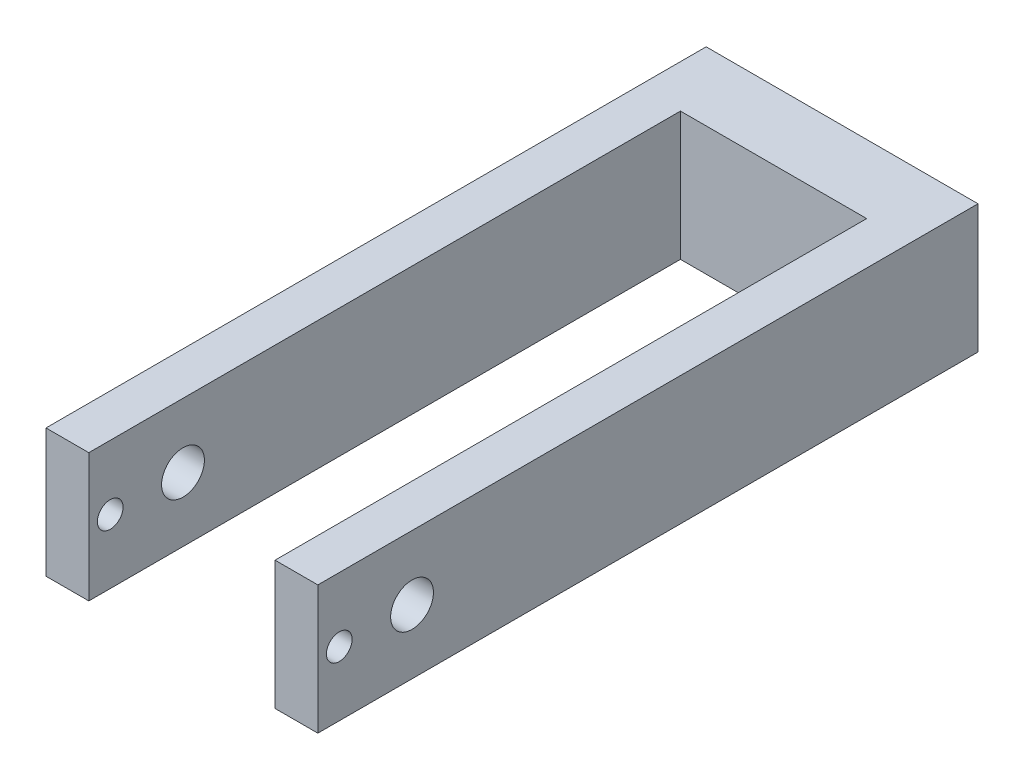
from build123d import *

# Parameters (mm, degrees)
SKETCH1_W           = 31.75
SKETCH1_H           = 15
BOSS_EXTRUDE1_DEPTH = 8
SKETCH2_W           = 5
SKETCH2_H           = 15
BOSS_EXTRUDE2_DEPTH = 69.1
SKETCH3_R           = 2.5
CUT_EXTRUDE1_DEPTH  = 69.1
SKETCH4_R           = 4
SKETCH4_R_2         = 2
CUT_EXTRUDE3_DEPTH  = 4
SKETCH5_R           = 1.5
CUT_EXTRUDE4_DEPTH  = 3
SKETCH6_R           = 1.5
CUT_EXTRUDE5_DEPTH  = 37


with BuildPart() as part:
    # Sketch1 → Boss-Extrude1 (new body)
    with BuildSketch(Plane.XY):
        with Locations((-0.926352113, 0.669031185)):
            Rectangle(SKETCH1_W, SKETCH1_H)
    extrude(amount=BOSS_EXTRUDE1_DEPTH)

    # Sketch2 → Boss-Extrude2 (add)
    with BuildSketch(Plane.XY.offset(8)):
        with Locations((-14.301352113, 0.669031185)):
            Rectangle(SKETCH2_W, SKETCH2_H)
        with Locations((12.448647887, 0.669031185)):
            Rectangle(SKETCH2_W, SKETCH2_H)
    extrude(amount=BOSS_EXTRUDE2_DEPTH)

    # Sketch3 → Cut-Extrude1 (cut)
    with BuildSketch(Plane(origin=(14.948647887, 0, 0), x_dir=(0, 0, -1), z_dir=(1, 0, 0))):
        with Locations(Location((-66.1, 0.669031185, 0), (0, 0, 90))):
            Circle(SKETCH3_R)
    extrude(amount=-CUT_EXTRUDE1_DEPTH, mode=Mode.SUBTRACT)

    # Sketch4 → Cut-Extrude3 (cut)
    with BuildSketch(Plane(origin=(0, 0, 0), x_dir=(-1, 0, 0), z_dir=(0, 0, -1))):
        with Locations((0.926352113, 0.669031185)):
            Circle(SKETCH4_R)
        with Locations((0.926352113, 0.669031185)):
            Circle(SKETCH4_R_2, mode=Mode.SUBTRACT)
    extrude(amount=-CUT_EXTRUDE3_DEPTH, mode=Mode.SUBTRACT)

    # Sketch5 → Cut-Extrude4 (cut)
    with BuildSketch(Plane.XZ.offset(6.830968815)):
        with Locations((-0.926352113, 4)):
            Circle(SKETCH5_R)
    extrude(amount=-CUT_EXTRUDE4_DEPTH, mode=Mode.SUBTRACT)

    # Sketch6 → Cut-Extrude5 (cut)
    with BuildSketch(Plane(origin=(14.948647887, 0, 0), x_dir=(0, 0, -1), z_dir=(1, 0, 0))):
        with Locations(Location((-74.6, 0.669031185, 0), (0, 0, 90))):
            Circle(SKETCH6_R)
    extrude(amount=-CUT_EXTRUDE5_DEPTH, mode=Mode.SUBTRACT)


solid = part.part
